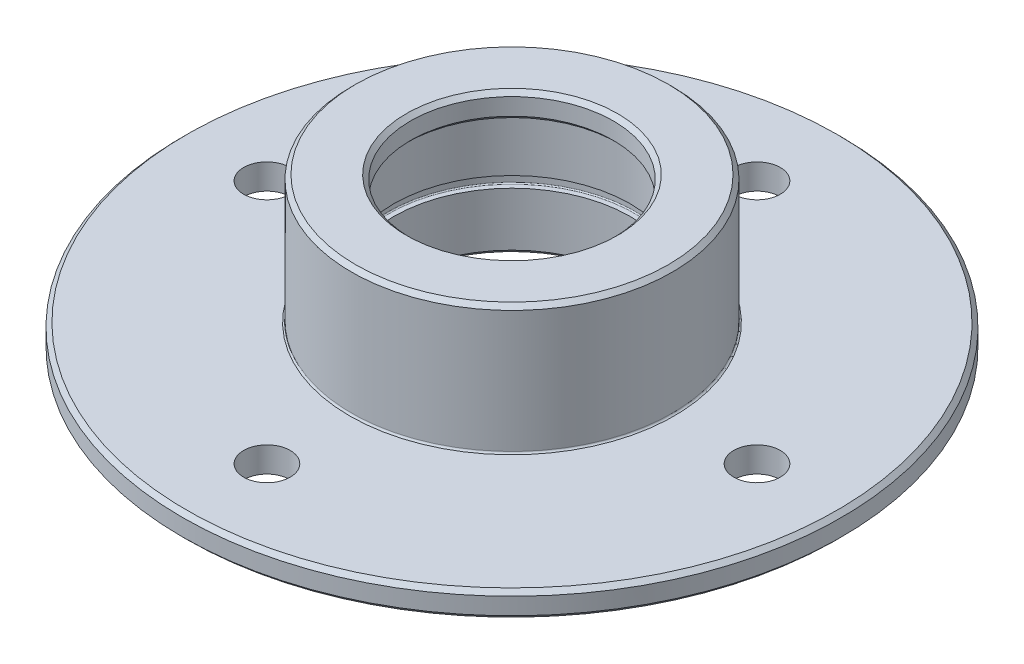
from build123d import *

# Parameters (mm, degrees)
M5_CLEARANCE_HOLE1_D = 5.5
FILLET1_R            = 0.2
CHAMFER1_SIZE        = 0.5


with BuildPart() as part:
    # Sketch1 → Revolve1 (revolve)
    with BuildSketch(Plane.XY, mode=Mode.PRIVATE) as revolve1_sk:
        Polygon((14, -3), (14, 12.15), (12, 12.15), (12, 15.15), (19, 15.15), (19, 0), (39, 0), (39, -3), align=None)
    revolve(revolve1_sk.sketch.rotate(Axis((0, 17.954019247, 0), (0, -1, 0)), 90), axis=Axis((0, 17.954019247, 0), (0, -1, 0)))

    # M5 Clearance Hole1 (through all)
    with Locations(Plane(origin=(0, 0, 0), x_dir=(1, 0, 0), z_dir=(0, 1, 0))):
        with Locations((0, 29), (29, 0), (0, -29), (-29, 0)):
            Hole(M5_CLEARANCE_HOLE1_D / 2)

    # Fillet1
    fillet1_edges = [part.edges().sort_by_distance(p)[0] for p in [
        (0, 0, -19),
        (0, 12.15, -14),
    ]]
    fillet(fillet1_edges, radius=FILLET1_R)

    # Chamfer1
    chamfer1_edges = [part.edges().sort_by_distance(p)[0] for p in [
        (0, 12.15, -12),
        (0, 15.15, -12),
        (0, 15.15, -19),
        (0, 0, -39),
        (0, -3, -39),
        (0, -3, -14),
    ]]
    chamfer(chamfer1_edges, length=CHAMFER1_SIZE)

    # Sketch14 → Groove for BS 3673 P4 - B028M, Internal Circlip1 (revolve, cut)
    with BuildSketch(Plane(origin=(0, 17.954019247, 0), x_dir=(0, 0, 1), z_dir=(-1, 0, 0))):
        with BuildLine():
            Line((14.57, -14.104019247), (12.6, -14.104019247))
            Line((12.6, -14.104019247), (12.6, -12.804019247))
            Line((12.6, -12.804019247), (14.57, -12.804019247))
            ThreePointArc((14.57, -12.804019247), (14.661923882, -12.842095365), (14.7, -12.934019247))
            Line((14.7, -12.934019247), (14.7, -13.974019247))
            ThreePointArc((14.7, -13.974019247), (14.661923882, -14.065943128), (14.57, -14.104019247))
        make_face()
    revolve(axis=Axis((0, -32.045980753, 0), (0, 1, 0)), mode=Mode.SUBTRACT)


solid = part.part
